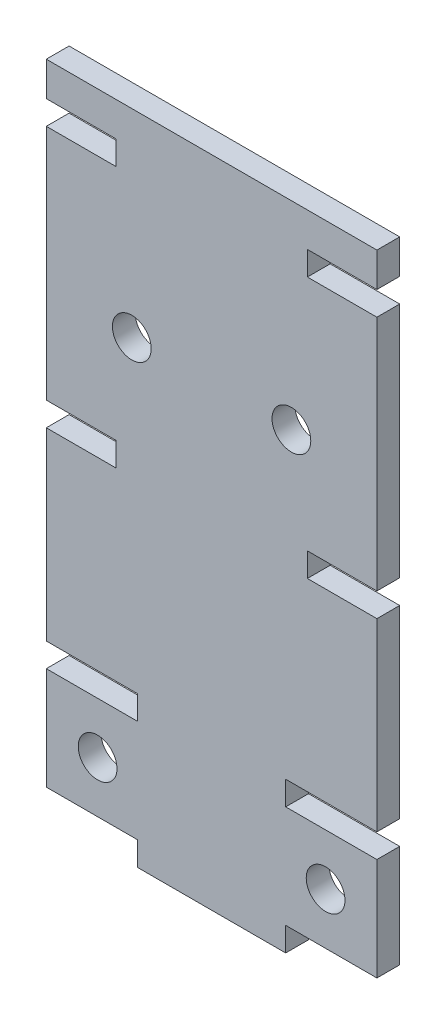
from build123d import *

# Parameters (mm, degrees)
SKETCH_1_W          = 13
SKETCH_1_H          = 2.1
SKETCH_1_W_2        = 8
EXTRUDE_3_DEPTH     = 2
SKETCH_2_W          = 6.1
SKETCH_2_H          = 2.1
CUT_EXTRUDE_1_DEPTH = 2
SKETCH_12_W         = 13
SKETCH_12_H         = 2.1
EXTRUDE_9_DEPTH     = 2
SKETCH_13_R         = 1.7
EXTRUDE_10_DEPTH    = 2
SKETCH_3_W          = 16.8
SKETCH_3_H          = 2.1
EXTRUDE_4_DEPTH     = 2
SKETCH_8_R          = 1.7
CUT_EXTRUDE_4_DEPTH = 10
SKETCH_9_W          = 16.8
SKETCH_9_H          = 2.1
CUT_EXTRUDE_5_DEPTH = 10
EXTRUDE_11_DEPTH    = 2


with BuildPart() as part:
    # 草图1 → 凸台-拉伸3 (new body)
    with BuildSketch(Plane.XY):
        Polygon((0, 39.1), (0, 11.1), (8, 11.1), (21, 11.1), (29, 11.1), (29, 39.1), align=None)
        with Locations((14.5, -1.05)):
            Rectangle(SKETCH_1_W, SKETCH_1_H)
        Polygon((0, 9), (0, 0), (8, 0), (21, 0), (29, 0), (29, 9), (21, 9), (8, 9), align=None)
        with Locations((25, 10.05)):
            Rectangle(SKETCH_1_W_2, SKETCH_1_H)
        with Locations((4, 10.05)):
            Rectangle(SKETCH_1_W_2, SKETCH_1_H)
    extrude(amount=EXTRUDE_3_DEPTH)

    # 草图2 → 切除-拉伸1 (cut)
    with BuildSketch(Plane.XY.offset(2)):
        with Locations((3.05, 17.25)):
            Rectangle(SKETCH_2_W, SKETCH_2_H)
        with Locations((25.95, 17.25)):
            Rectangle(SKETCH_2_W, SKETCH_2_H)
    extrude(amount=-CUT_EXTRUDE_1_DEPTH, mode=Mode.SUBTRACT)

    # 草图12 → 凸台-拉伸9 (add)
    with BuildSketch(Plane.XY.offset(2)):
        with Locations((14.5, 10.05)):
            Rectangle(SKETCH_12_W, SKETCH_12_H)
    extrude(amount=-EXTRUDE_9_DEPTH)

    # 草图13 → 凸台-拉伸10 (add)
    with BuildSketch(Plane.XY.offset(2)):
        Polygon((8, -2.1), (0, -2.1), (0, -11.1), (8, -11.1), (8, -13.2), (21, -13.2), (21, -11.1), (29, -11.1), (29, -2.1), (21, -2.1), align=None)
        with Locations((4.5, -6.6)):
            Circle(SKETCH_13_R, mode=Mode.SUBTRACT)
        with Locations(Location((24.5, -6.6, 0), (0, 0, 180))):
            Circle(SKETCH_13_R, mode=Mode.SUBTRACT)
    extrude(amount=-EXTRUDE_10_DEPTH)

    # 草图3 → 凸台-拉伸4 (add)
    with BuildSketch(Plane.XY.offset(2)):
        with Locations((14.5, 40.15)):
            Rectangle(SKETCH_3_W, SKETCH_3_H)
    extrude(amount=-EXTRUDE_4_DEPTH)

    # 草图8 → 切除-拉伸4 (cut)
    with BuildSketch(Plane.XY.offset(2)):
        with Locations((21.5, 26.8)):
            Circle(SKETCH_8_R)
        with Locations((7.5, 26.8)):
            Circle(SKETCH_8_R)
    extrude(amount=-CUT_EXTRUDE_4_DEPTH, mode=Mode.SUBTRACT)

    # 草图9 → 切除-拉伸5 (cut)
    with BuildSketch(Plane.XY.offset(2)):
        with Locations((14.5, 40.15)):
            Rectangle(SKETCH_9_W, SKETCH_9_H)
    extrude(amount=-CUT_EXTRUDE_5_DEPTH, mode=Mode.SUBTRACT)

    # 草图11 → 凸台-拉伸11 (add)
    with BuildSketch(Plane.XY.offset(2)):
        Polygon((6.1, 39.1), (6.1, 41.2), (0, 41.2), (0, 44.2), (29, 44.2), (29, 41.2), (22.9, 41.2), (22.9, 39.1), align=None)
    extrude(amount=-EXTRUDE_11_DEPTH)


solid = part.part
